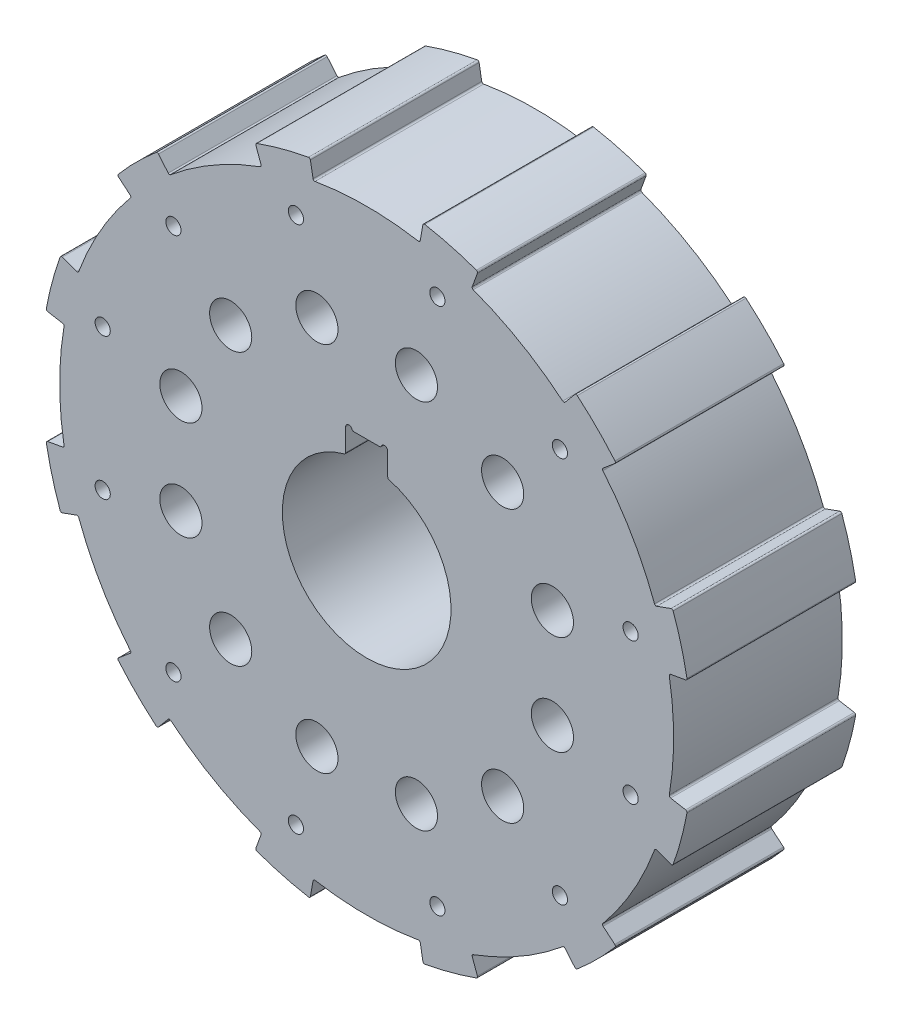
from build123d import *

# Parameters (mm, degrees)
SKETCH1_R           = 3.175
SKETCH1_R_2         = 1.143
BOSS_EXTRUDE1_DEPTH = 25.4
FILLET1_R           = 0.254


with BuildPart() as part:
    # Sketch1 → Boss-Extrude1 (new body)
    with BuildSketch(Plane.XY):
        with BuildLine():
            Line((-8.512580966, 48.277245668), (-8.027407957, 45.525692806))
            ThreePointArc((-8.027407957, 45.525692806), (0, 46.228), (8.027407957, 45.525692806))
            Line((8.027407957, 45.525692806), (8.512580966, 48.277245668))
            ThreePointArc((8.512580966, 48.277245668), (12.687827229, 47.351615856), (16.766511466, 46.065611656))
            Line((16.766511466, 46.065611656), (15.810907186, 43.440110474))
            ThreePointArc((15.810907186, 43.440110474), (23.114, 40.034622366), (29.714785621, 35.412702517))
            Line((29.714785621, 35.412702517), (31.510734202, 37.553030691))
            ThreePointArc((31.510734202, 37.553030691), (34.663788627, 34.663788627), (37.553030691, 31.510734202))
            Line((37.553030691, 31.510734202), (35.412702517, 29.714785621))
            ThreePointArc((35.412702517, 29.714785621), (40.034622366, 23.114), (43.440110474, 15.810907186))
            Line((43.440110474, 15.810907186), (46.065611656, 16.766511466))
            ThreePointArc((46.065611656, 16.766511466), (47.351615856, 12.687827229), (48.277245668, 8.512580966))
            Line((48.277245668, 8.512580966), (45.525692806, 8.027407957))
            ThreePointArc((45.525692806, 8.027407957), (46.228, 0), (45.525692806, -8.027407957))
            Line((45.525692806, -8.027407957), (48.277245668, -8.512580966))
            ThreePointArc((48.277245668, -8.512580966), (47.351615856, -12.687827229), (46.065611656, -16.766511466))
            Line((46.065611656, -16.766511466), (43.440110474, -15.810907186))
            ThreePointArc((43.440110474, -15.810907186), (40.034622366, -23.114), (35.412702517, -29.714785621))
            Line((35.412702517, -29.714785621), (37.553030691, -31.510734202))
            ThreePointArc((37.553030691, -31.510734202), (34.663788627, -34.663788627), (31.510734202, -37.553030691))
            Line((31.510734202, -37.553030691), (29.714785621, -35.412702517))
            ThreePointArc((29.714785621, -35.412702517), (23.114, -40.034622366), (15.810907186, -43.440110474))
            Line((15.810907186, -43.440110474), (16.766511466, -46.065611656))
            ThreePointArc((16.766511466, -46.065611656), (12.687827229, -47.351615856), (8.512580966, -48.277245668))
            Line((8.512580966, -48.277245668), (8.027407957, -45.525692806))
            ThreePointArc((8.027407957, -45.525692806), (0, -46.228), (-8.027407957, -45.525692806))
            Line((-8.027407957, -45.525692806), (-8.512580966, -48.277245668))
            ThreePointArc((-8.512580966, -48.277245668), (-12.687827229, -47.351615856), (-16.766511466, -46.065611656))
            Line((-16.766511466, -46.065611656), (-15.810907186, -43.440110474))
            ThreePointArc((-15.810907186, -43.440110474), (-23.114, -40.034622366), (-29.714785621, -35.412702517))
            Line((-29.714785621, -35.412702517), (-31.510734202, -37.553030691))
            ThreePointArc((-31.510734202, -37.553030691), (-34.663788627, -34.663788627), (-37.553030691, -31.510734202))
            Line((-37.553030691, -31.510734202), (-35.412702517, -29.714785621))
            ThreePointArc((-35.412702517, -29.714785621), (-40.034622366, -23.114), (-43.440110474, -15.810907186))
            Line((-43.440110474, -15.810907186), (-46.065611656, -16.766511466))
            ThreePointArc((-46.065611656, -16.766511466), (-47.351615856, -12.687827229), (-48.277245668, -8.512580966))
            Line((-48.277245668, -8.512580966), (-45.525692806, -8.027407957))
            ThreePointArc((-45.525692806, -8.027407957), (-46.228, 0), (-45.525692806, 8.027407957))
            Line((-45.525692806, 8.027407957), (-48.277245668, 8.512580966))
            ThreePointArc((-48.277245668, 8.512580966), (-47.351615856, 12.687827229), (-46.065611656, 16.766511466))
            Line((-46.065611656, 16.766511466), (-43.440110474, 15.810907186))
            ThreePointArc((-43.440110474, 15.810907186), (-40.034622366, 23.114), (-35.412702517, 29.714785621))
            Line((-35.412702517, 29.714785621), (-37.553030691, 31.510734202))
            ThreePointArc((-37.553030691, 31.510734202), (-34.663788627, 34.663788627), (-31.510734202, 37.553030691))
            Line((-31.510734202, 37.553030691), (-29.714785621, 35.412702517))
            ThreePointArc((-29.714785621, 35.412702517), (-23.114, 40.034622366), (-15.810907186, 43.440110474))
            Line((-15.810907186, 43.440110474), (-16.766511466, 46.065611656))
            ThreePointArc((-16.766511466, 46.065611656), (-12.687827229, 47.351615856), (-8.512580966, 48.277245668))
        make_face()
        with Locations((-7.49436427, 27.969348226)):
            Circle(SKETCH1_R, mode=Mode.SUBTRACT)
        with Locations((7.49436427, 27.969348226)):
            Circle(SKETCH1_R, mode=Mode.SUBTRACT)
        with Locations((20.474983956, 20.474983956)):
            Circle(SKETCH1_R, mode=Mode.SUBTRACT)
        with Locations((27.969348226, 7.49436427)):
            Circle(SKETCH1_R, mode=Mode.SUBTRACT)
        with Locations((27.969348226, -7.49436427)):
            Circle(SKETCH1_R, mode=Mode.SUBTRACT)
        with Locations((20.474983956, -20.474983956)):
            Circle(SKETCH1_R, mode=Mode.SUBTRACT)
        with Locations((7.49436427, -27.969348226)):
            Circle(SKETCH1_R, mode=Mode.SUBTRACT)
        with Locations((-7.49436427, -27.969348226)):
            Circle(SKETCH1_R, mode=Mode.SUBTRACT)
        with Locations((-20.474983956, -20.474983956)):
            Circle(SKETCH1_R, mode=Mode.SUBTRACT)
        with Locations((-27.969348226, -7.49436427)):
            Circle(SKETCH1_R, mode=Mode.SUBTRACT)
        with Locations((-27.969348226, 7.49436427)):
            Circle(SKETCH1_R, mode=Mode.SUBTRACT)
        with Locations((-20.474983956, 20.474983956)):
            Circle(SKETCH1_R, mode=Mode.SUBTRACT)
        with Locations((-10.649886068, 39.7459159)):
            Circle(SKETCH1_R_2, mode=Mode.SUBTRACT)
        with Locations((10.649886068, 39.7459159)):
            Circle(SKETCH1_R_2, mode=Mode.SUBTRACT)
        with Locations((29.096029832, 29.096029832)):
            Circle(SKETCH1_R_2, mode=Mode.SUBTRACT)
        with Locations((39.7459159, 10.649886068)):
            Circle(SKETCH1_R_2, mode=Mode.SUBTRACT)
        with Locations((39.7459159, -10.649886068)):
            Circle(SKETCH1_R_2, mode=Mode.SUBTRACT)
        with Locations((29.096029832, -29.096029832)):
            Circle(SKETCH1_R_2, mode=Mode.SUBTRACT)
        with Locations((10.649886068, -39.7459159)):
            Circle(SKETCH1_R_2, mode=Mode.SUBTRACT)
        with Locations((-10.649886068, -39.7459159)):
            Circle(SKETCH1_R_2, mode=Mode.SUBTRACT)
        with Locations((-29.096029832, -29.096029832)):
            Circle(SKETCH1_R_2, mode=Mode.SUBTRACT)
        with Locations((-39.7459159, -10.649886068)):
            Circle(SKETCH1_R_2, mode=Mode.SUBTRACT)
        with Locations((-39.7459159, 10.649886068)):
            Circle(SKETCH1_R_2, mode=Mode.SUBTRACT)
        with Locations((-29.096029832, 29.096029832)):
            Circle(SKETCH1_R_2, mode=Mode.SUBTRACT)
        with BuildLine():
            Line((-1.94857951, 15.852722124), (1.94857951, 15.852722124))
            ThreePointArc((1.94857951, 15.852722124), (2.095226479, 15.899331993), (2.188053007, 16.022055458))
            ThreePointArc((2.188053007, 16.022055458), (2.752903805, 16.353406193), (3.175, 15.852722124))
            Line((3.175, 15.852722124), (3.175, 12.491920389))
            ThreePointArc((3.175, 12.491920389), (3.227017619, 12.337910267), (3.361764706, 12.246980773))
            ThreePointArc((3.361764706, 12.246980773), (0, -12.7), (-3.361764706, 12.246980773))
            ThreePointArc((-3.361764706, 12.246980773), (-3.227017619, 12.337910267), (-3.175, 12.491920389))
            Line((-3.175, 12.491920389), (-3.175, 15.852722124))
            ThreePointArc((-3.175, 15.852722124), (-2.752903805, 16.353406193), (-2.188053007, 16.022055458))
            ThreePointArc((-2.188053007, 16.022055458), (-2.095226479, 15.899331993), (-1.94857951, 15.852722124))
        make_face(mode=Mode.SUBTRACT)
    extrude(amount=BOSS_EXTRUDE1_DEPTH)

    # Fillet1
    fillet1_edges = [part.edges().sort_by_distance(p)[0] for p in [
        (-8.512580966, 48.277245668, 12.7),
        (-8.027407957, 45.525692806, 12.7),
        (8.027407957, 45.525692806, 12.7),
        (8.512580966, 48.277245668, 12.7),
        (16.766511466, 46.065611656, 12.7),
        (15.810907186, 43.440110474, 12.7),
        (29.714785621, 35.412702517, 12.7),
        (31.510734202, 37.553030691, 12.7),
        (37.553030691, 31.510734202, 12.7),
        (35.412702517, 29.714785621, 12.7),
        (43.440110474, 15.810907186, 12.7),
        (46.065611656, 16.766511466, 12.7),
        (48.277245668, 8.512580966, 12.7),
        (45.525692806, 8.027407957, 12.7),
        (45.525692806, -8.027407957, 12.7),
        (48.277245668, -8.512580966, 12.7),
        (46.065611656, -16.766511466, 12.7),
        (43.440110474, -15.810907186, 12.7),
        (35.412702517, -29.714785621, 12.7),
        (37.553030691, -31.510734202, 12.7),
        (31.510734202, -37.553030691, 12.7),
        (29.714785621, -35.412702517, 12.7),
        (15.810907186, -43.440110474, 12.7),
        (16.766511466, -46.065611656, 12.7),
        (8.512580966, -48.277245668, 12.7),
        (8.027407957, -45.525692806, 12.7),
        (-8.027407957, -45.525692806, 12.7),
        (-8.512580966, -48.277245668, 12.7),
        (-16.766511466, -46.065611656, 12.7),
        (-15.810907186, -43.440110474, 12.7),
        (-29.714785621, -35.412702517, 12.7),
        (-31.510734202, -37.553030691, 12.7),
        (-37.553030691, -31.510734202, 12.7),
        (-35.412702517, -29.714785621, 12.7),
        (-43.440110474, -15.810907186, 12.7),
        (-46.065611656, -16.766511466, 12.7),
        (-48.277245668, -8.512580966, 12.7),
        (-45.525692806, -8.027407957, 12.7),
        (-45.525692806, 8.027407957, 12.7),
        (-48.277245668, 8.512580966, 12.7),
        (-46.065611656, 16.766511466, 12.7),
        (-43.440110474, 15.810907186, 12.7),
        (-35.412702517, 29.714785621, 12.7),
        (-37.553030691, 31.510734202, 12.7),
        (-31.510734202, 37.553030691, 12.7),
        (-29.714785621, 35.412702517, 12.7),
        (-15.810907186, 43.440110474, 12.7),
        (-16.766511466, 46.065611656, 12.7),
    ]]
    fillet(fillet1_edges, radius=FILLET1_R)


solid = part.part
